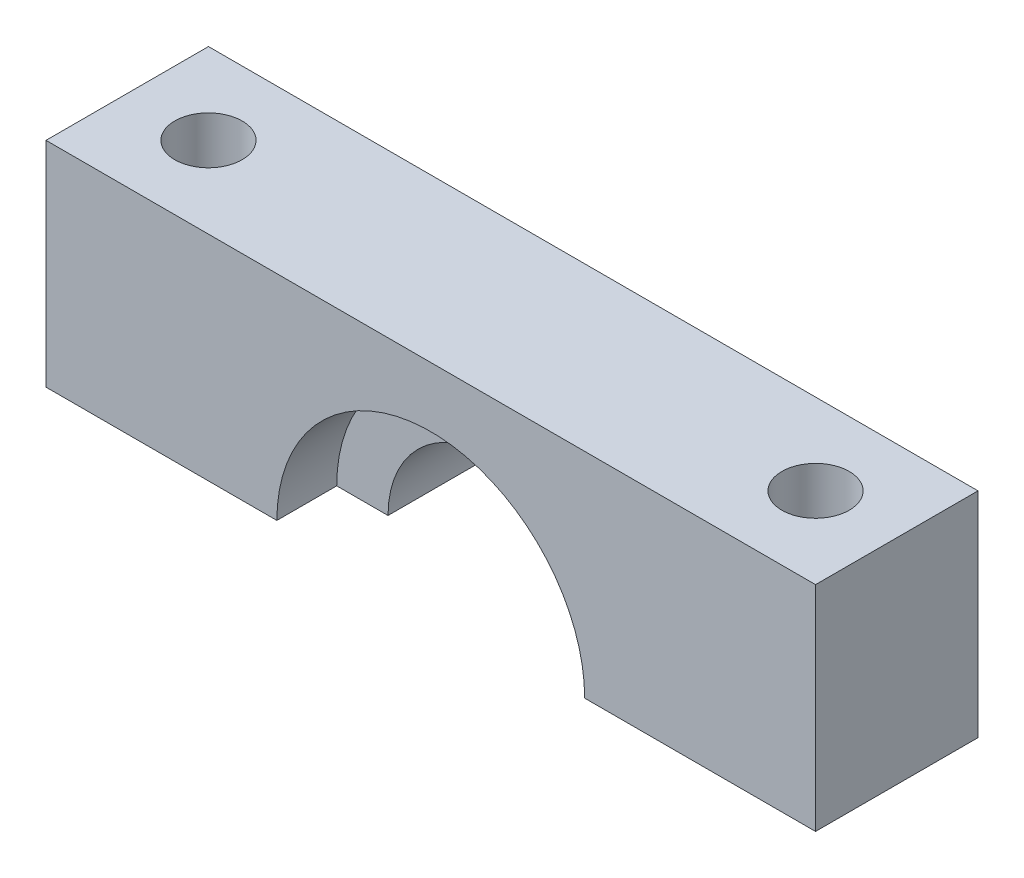
from build123d import *

# Parameters (mm, degrees)
SKETCH1_W           = 45.72
SKETCH1_H           = 12.7
BOSS_EXTRUDE1_DEPTH = 9.652
CUT_EXTRUDE3_DEPTH  = 3.556
CUT_EXTRUDE5_DEPTH  = 25.496189826
SKETCH4_R           = 2
CUT_EXTRUDE6_DEPTH  = 28.875270474


with BuildPart() as part:
    # Sketch1 → Boss-Extrude1 (new body)
    with BuildSketch(Plane.XY):
        Rectangle(SKETCH1_W, SKETCH1_H)
    extrude(amount=BOSS_EXTRUDE1_DEPTH)

    # Sketch2 → Cut-Extrude3 (cut)
    with BuildSketch(Plane.XY.offset(9.652)):
        with BuildLine():
            Line((-9.144, -6.35), (9.144, -6.35))
            ThreePointArc((9.144, -6.35), (0, 2.794), (-9.144, -6.35))
        make_face()
    extrude(amount=-CUT_EXTRUDE3_DEPTH, mode=Mode.SUBTRACT)

    # Sketch3 → Cut-Extrude5 (cut, through all)
    with BuildSketch(Plane.XY.offset(6.096)):
        with BuildLine():
            Line((-6.096, -6.35), (6.096, -6.35))
            ThreePointArc((6.096, -6.35), (0, -0.254), (-6.096, -6.35))
        make_face()
    extrude(amount=-CUT_EXTRUDE5_DEPTH, mode=Mode.SUBTRACT)

    # Sketch4 → Cut-Extrude6 (cut, through all)
    with BuildSketch(Plane(origin=(0, 6.35, 0), x_dir=(1, 0, 0), z_dir=(0, 1, 0))):
        with Locations((-18.034, -4.826)):
            Circle(SKETCH4_R)
        with Locations((18.034, -4.826)):
            Circle(SKETCH4_R)
    extrude(amount=-CUT_EXTRUDE6_DEPTH, mode=Mode.SUBTRACT)


solid = part.part
